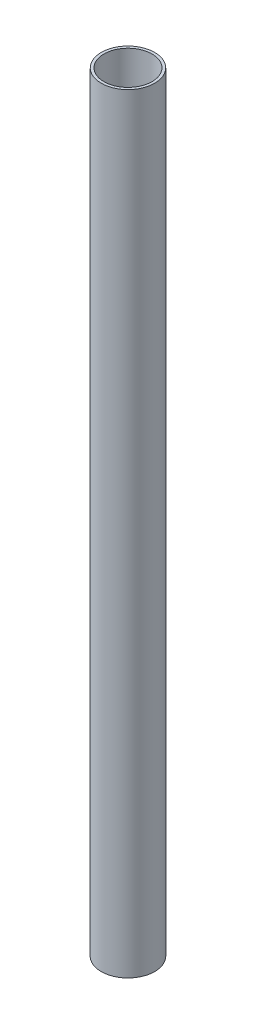
from build123d import *

# Parameters (mm, degrees)
SKETCH1_R           = 31.75
BOSS_EXTRUDE1_DEPTH = 914.4
SKETCH2_R           = 28.575
CUT_EXTRUDE1_DEPTH  = 916.501766792


with BuildPart() as part:
    # Sketch1 → Boss-Extrude1 (new body)
    with BuildSketch(Plane(origin=(0, 0, 0), x_dir=(1, 0, 0), z_dir=(0, 1, 0))):
        with Locations(Location((0, 0, 0), (0, 0, 270))):
            Circle(SKETCH1_R)
    extrude(amount=-BOSS_EXTRUDE1_DEPTH)

    # Sketch2 → Cut-Extrude1 (cut, through all)
    with BuildSketch(Plane(origin=(0, 0, 0), x_dir=(1, 0, 0), z_dir=(0, 1, 0))):
        with Locations(Location((0, 0, 0), (0, 0, 270))):
            Circle(SKETCH2_R)
    extrude(amount=-CUT_EXTRUDE1_DEPTH, mode=Mode.SUBTRACT)


solid = part.part
